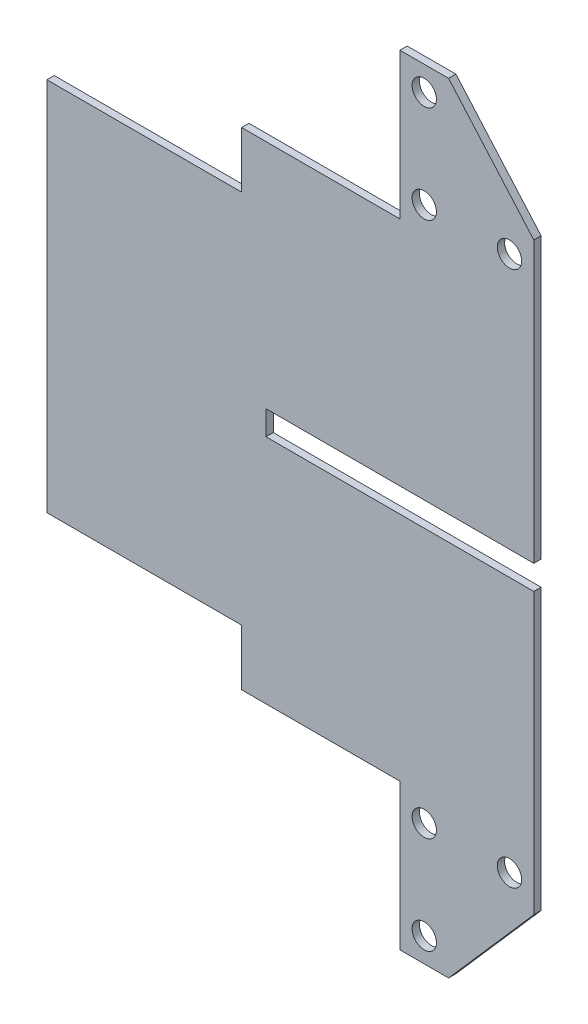
from build123d import *

# Parameters (mm, degrees)
ESQUISSE1_R        = 5
BOSS_EXTRU_1_DEPTH = 3


with BuildPart() as part:
    # Esquisse1 → Boss.-Extru.1 (new body)
    with BuildSketch(Plane.XY):
        Polygon((80, 77), (0, 77), (0, 0), (90, 0), (90, 5), (200, 5), (200, 120), (165, 160), (145, 160), (145, 100), (80, 100), align=None)
        with Locations((155, 150)):
            Circle(ESQUISSE1_R, mode=Mode.SUBTRACT)
        with Locations((155, 110)):
            Circle(ESQUISSE1_R, mode=Mode.SUBTRACT)
        with Locations((190, 110)):
            Circle(ESQUISSE1_R, mode=Mode.SUBTRACT)
    boss_extru_1 = extrude(amount=BOSS_EXTRU_1_DEPTH)

    # Symétrie1: Boss.-Extru.1 across plane
    add(boss_extru_1.mirror(Plane(origin=(0, 0, 3), x_dir=(0, 0, 1), z_dir=(0, 1, 0))))


solid = part.part
